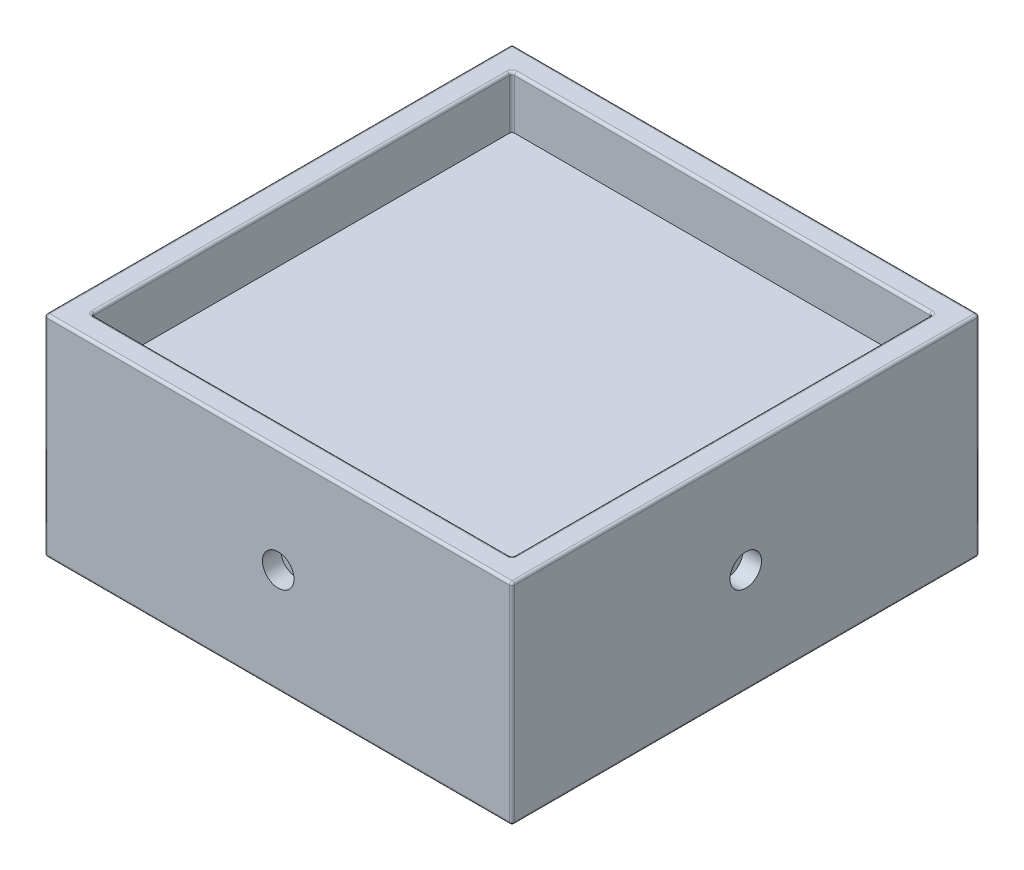
from build123d import *

# Parameters (mm, degrees)
SKETCH2_W           = 89
SKETCH2_H           = 89
BOSS_EXTRUDE1_DEPTH = 40
SKETCH5_W           = 80
SKETCH5_H           = 80
CUT_EXTRUDE3_DEPTH  = 10
SKETCH4_W           = 80
SKETCH4_H           = 80
CUT_EXTRUDE5_DEPTH  = 10
CUT_EXTRUDE6_DEPTH  = 3.5
CIRPATTERN1_COUNT   = 4
FILLET1_R           = 0.5


with BuildPart() as part:
    # Sketch2 → Boss-Extrude1 (new body)
    with BuildSketch(Plane(origin=(0, 0, 0), x_dir=(1, 0, 0), z_dir=(0, 1, 0))):
        Rectangle(SKETCH2_W, SKETCH2_H)
    extrude(amount=BOSS_EXTRUDE1_DEPTH)

    # Sketch5 → Cut-Extrude3 (cut)
    with BuildSketch(Plane.XZ):
        Rectangle(SKETCH5_W, SKETCH5_H)
    extrude(amount=-CUT_EXTRUDE3_DEPTH, mode=Mode.SUBTRACT)

    # Sketch4 → Cut-Extrude5 (cut)
    with BuildSketch(Plane(origin=(0, 40, 0), x_dir=(1, 0, 0), z_dir=(0, 1, 0))):
        Rectangle(SKETCH4_W, SKETCH4_H)
    extrude(amount=-CUT_EXTRUDE5_DEPTH, mode=Mode.SUBTRACT)

    # Sketch6 → Cut-Extrude6 (cut)
    with BuildSketch(Plane(origin=(44.5, 0, 0), x_dir=(0, 0, -1), z_dir=(1, 0, 0))):
        with BuildLine():
            ThreePointArc((3, 20), (2.121320344, 22.121320344), (0, 23))
            Line((0, 23), (0, 17))
            ThreePointArc((0, 17), (2.121320344, 17.878679656), (3, 20))
        make_face()
        with BuildLine():
            Line((0, 17), (0, 23))
            ThreePointArc((0, 23), (-3, 20), (0, 17))
        make_face()
    cut_extrude6 = extrude(amount=-CUT_EXTRUDE6_DEPTH, mode=Mode.SUBTRACT)

    # CirPattern1: Cut-Extrude6 ×4 about axis
    cirpattern1_axis = Axis((0, 10, 0), (0, -1, 0))
    for i in range(1, CIRPATTERN1_COUNT):
        add(cut_extrude6.rotate(cirpattern1_axis, i * 360 / CIRPATTERN1_COUNT), mode=Mode.SUBTRACT)

    # Fillet1
    fillet1_edges = [part.edges().sort_by_distance(p)[0] for p in [
        (-44.5, 40, 0),
        (0, 40, 44.5),
        (40, 5, 40),
        (40, 5, -40),
        (-40, 5, -40),
        (-40, 5, 40),
        (40, 0, 0),
        (0, 0, 40),
        (-40, 0, 0),
        (0, 0, -40),
        (40, 35, -40),
        (40, 35, 40),
        (-40, 35, 40),
        (-40, 35, -40),
        (40, 40, 0),
        (0, 40, -40),
        (-40, 40, 0),
        (0, 40, 40),
        (44.5, 40, 0),
        (0, 0, 44.5),
        (-44.5, 0, 0),
        (0, 0, -44.5),
        (44.5, 0, 0),
        (44.5, 20, 44.5),
        (-44.5, 20, 44.5),
        (-44.5, 20, -44.5),
        (44.5, 20, -44.5),
        (0, 40, -44.5),
    ]]
    fillet(fillet1_edges, radius=FILLET1_R)


solid = part.part
